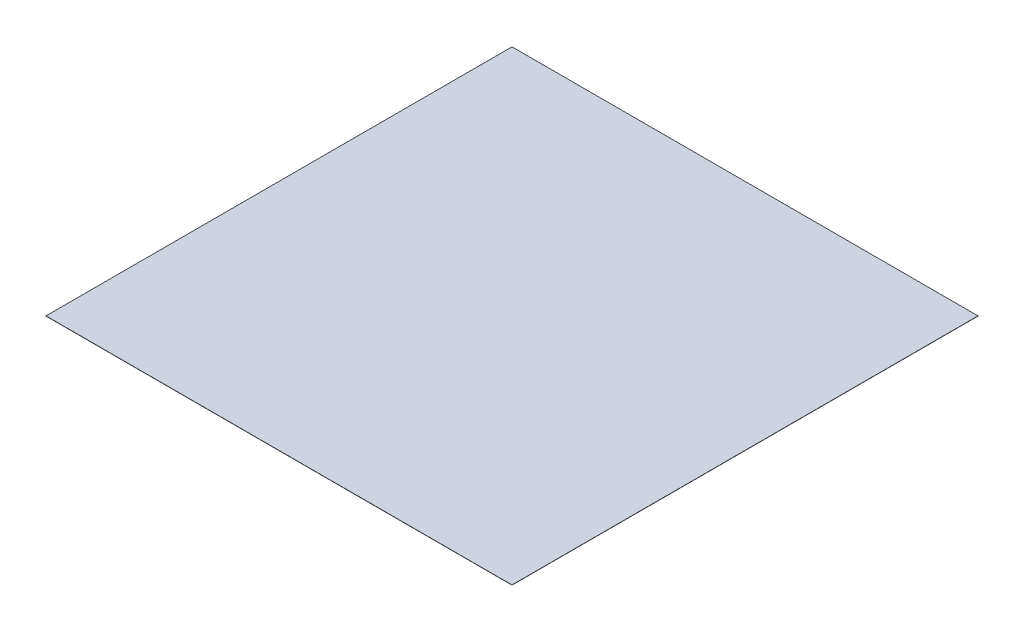
from build123d import *

# Parameters (mm, degrees)
SKETCH1_W           = 210
SKETCH1_H           = 210
SKETCH1_W_2         = 0.02
SKETCH1_H_2         = 0.02
BOSS_EXTRUDE1_DEPTH = 0.1


with BuildPart() as part:
    # Sketch1 → Boss-Extrude1 (new body)
    with BuildSketch(Plane(origin=(0, 0, 0), x_dir=(1, 0, 0), z_dir=(0, 1, 0))):
        with Locations((105, 105)):
            Rectangle(SKETCH1_W, SKETCH1_H)
        with Locations((105, 105)):
            Rectangle(SKETCH1_W_2, SKETCH1_H_2, mode=Mode.SUBTRACT)
    extrude(amount=BOSS_EXTRUDE1_DEPTH)


solid = part.part
